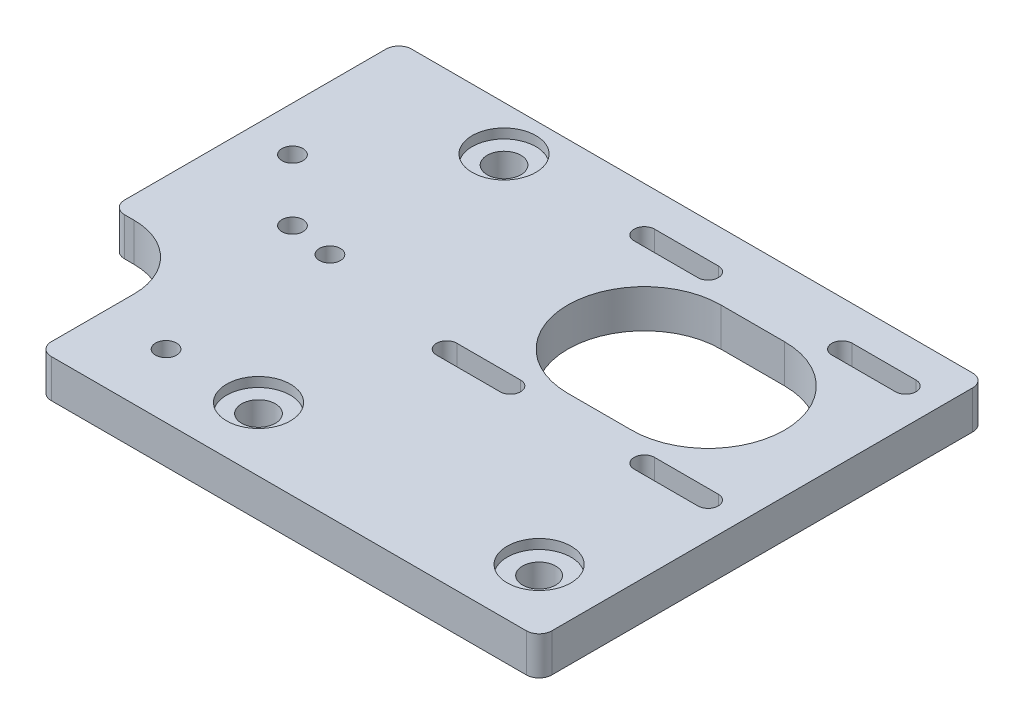
from build123d import *

# Parameters (mm, degrees)
SKETCH3_R                   = 2.6
BOSS_EXTRUDE1_DEPTH         = 6
FILLET1_R                   = 10
M3_CLEARANCE_HOLE1_D        = 3.2
M4X0_7_TAPPED_HOLE1_D       = 3.3
FILLET2_R                   = 2
SKETCH5_R                   = 5
COUNTERBORE_DEPTH           = 1.5
SKETCH14_R                  = 5
SKETCH14_R_2                = 1.6
HOLE_FILLER_DEPTH           = 6
M5_HOLE_RELOCATION_OPTION_R = 5
CUT_EXTRUDE1_DEPTH          = 1.5
M5_CLEARANCE_HOLE1_D        = 5.3
M4X0_7_TAPPED_HOLE2_D       = 3.3


with BuildPart() as part:
    # Sketch3 → Boss-Extrude1 (new body)
    with BuildSketch(Plane(origin=(0, 0, 0), x_dir=(1, 0, 0), z_dir=(0, 1, 0))):
        Polygon((0, 0), (78.5, 0), (78.5, 70), (0, 70), (-13.5, 70), (-13.5, 25), (0, 25), align=None)
        with Locations(Location((10, 56, 0), (0, 0, 270))):
            Circle(SKETCH3_R, mode=Mode.SUBTRACT)
        with Locations(Location((10, 10, 0), (0, 0, 270))):
            Circle(SKETCH3_R, mode=Mode.SUBTRACT)
        with Locations(Location((68.5, 10, 0), (0, 0, 270))):
            Circle(SKETCH3_R, mode=Mode.SUBTRACT)
        with Locations(Location((30, 10, 0), (0, 0, 270))):
            Circle(SKETCH3_R, mode=Mode.SUBTRACT)
        with BuildLine():
            Line((47.5, 59.5), (57.5, 59.5))
            ThreePointArc((57.5, 59.5), (69.5, 47.5), (57.5, 35.5))
            Line((57.5, 35.5), (47.5, 35.5))
            ThreePointArc((47.5, 35.5), (35.5, 47.5), (47.5, 59.5))
        make_face(mode=Mode.SUBTRACT)
        with BuildLine():
            Line((32, 64.6), (42, 64.6))
            ThreePointArc((42, 64.6), (43.6, 63), (42, 61.4))
            Line((42, 61.4), (32, 61.4))
            ThreePointArc((32, 61.4), (30.4, 63), (32, 64.6))
        make_face(mode=Mode.SUBTRACT)
        with BuildLine():
            Line((63, 64.6), (73, 64.6))
            ThreePointArc((73, 64.6), (74.6, 63), (73, 61.4))
            Line((73, 61.4), (63, 61.4))
            ThreePointArc((63, 61.4), (61.4, 63), (63, 64.6))
        make_face(mode=Mode.SUBTRACT)
        with BuildLine():
            Line((63, 33.6), (73, 33.6))
            ThreePointArc((73, 33.6), (74.6, 32), (73, 30.4))
            Line((73, 30.4), (63, 30.4))
            ThreePointArc((63, 30.4), (61.4, 32), (63, 33.6))
        make_face(mode=Mode.SUBTRACT)
        with BuildLine():
            Line((32, 33.6), (42, 33.6))
            ThreePointArc((42, 33.6), (43.6, 32), (42, 30.4))
            Line((42, 30.4), (32, 30.4))
            ThreePointArc((32, 30.4), (30.4, 32), (32, 33.6))
        make_face(mode=Mode.SUBTRACT)
    extrude(amount=BOSS_EXTRUDE1_DEPTH)

    # Fillet1
    fillet1_edges = [part.edges().sort_by_distance(p)[0] for p in [
        (0, 3, -25),
    ]]
    fillet(fillet1_edges, radius=FILLET1_R)

    # M3 Clearance Hole1 (through all)
    with Locations(Plane(origin=(0, 6, 0), x_dir=(1, 0, 0), z_dir=(0, 1, 0))):
        with Locations((10, 64.325), (-6.5, 64.325)):
            Hole(M3_CLEARANCE_HOLE1_D / 2)

    # M4x0.7 Tapped Hole1 (through all)
    with Locations(Plane(origin=(0, 6, 0), x_dir=(1, 0, 0), z_dir=(0, 1, 0))):
        with Locations((-6.5, 46.325), (10, 35.7)):
            Hole(M4X0_7_TAPPED_HOLE1_D / 2)

    # Fillet2
    fillet2_edges = [part.edges().sort_by_distance(p)[0] for p in [
        (-13.5, 3, -25),
        (-13.5, 3, -70),
        (78.5, 3, -70),
        (78.5, 3, 0),
        (0, 3, 0),
    ]]
    fillet(fillet2_edges, radius=FILLET2_R)

    # Sketch5 → Counterbore (cut)
    with BuildSketch(Plane(origin=(0, 6, 0), x_dir=(1, 0, 0), z_dir=(0, 1, 0))):
        with Locations(Location((10, 56, 0), (0, 0, 270))):
            Circle(SKETCH5_R)
        with Locations(Location((10, 10, 0), (0, 0, 270))):
            Circle(SKETCH5_R)
        with Locations(Location((30, 10, 0), (0, 0, 270))):
            Circle(SKETCH5_R)
        with Locations(Location((68.5, 10, 0), (0, 0, 270))):
            Circle(SKETCH5_R)
    extrude(amount=-COUNTERBORE_DEPTH, mode=Mode.SUBTRACT)

    # Sketch14 → Hole Filler (add)
    with BuildSketch(Plane(origin=(0, 6, 0), x_dir=(1, 0, 0), z_dir=(0, 1, 0))):
        with Locations((10, 10)):
            Circle(SKETCH14_R)
        with Locations((10, 56)):
            Circle(SKETCH14_R)
        with Locations((-6.5, 64.325)):
            Circle(SKETCH14_R_2)
        with Locations((10, 64.325)):
            Circle(SKETCH14_R_2)
        with Locations((30, 10)):
            Circle(SKETCH14_R)
    extrude(amount=-HOLE_FILLER_DEPTH)

    # M5 hole relocation option → Cut-Extrude1 (cut)
    with BuildSketch(Plane(origin=(0, 6, 0), x_dir=(1, 0, 0), z_dir=(0, 1, 0))):
        with Locations(Location((24.5, 10, 0), (0, 0, 270))):
            Circle(M5_HOLE_RELOCATION_OPTION_R)
        with Locations(Location((10, 63, 0), (0, 0, 270))):
            Circle(M5_HOLE_RELOCATION_OPTION_R)
    extrude(amount=-CUT_EXTRUDE1_DEPTH, mode=Mode.SUBTRACT)

    # M5 Clearance Hole1 (through all)
    with Locations(Plane(origin=(0, 4.5, 0), x_dir=(1, 0, 0), z_dir=(0, 1, 0))):
        with Locations((24.5, 10), (10, 63)):
            Hole(M5_CLEARANCE_HOLE1_D / 2)

    # M4x0.7 Tapped Hole2 (through all)
    with Locations(Plane(origin=(0, 6, 0), x_dir=(1, 0, 0), z_dir=(0, 1, 0))):
        with Locations((10, 10), (3.145, 36.68)):
            Hole(M4X0_7_TAPPED_HOLE2_D / 2)


solid = part.part
